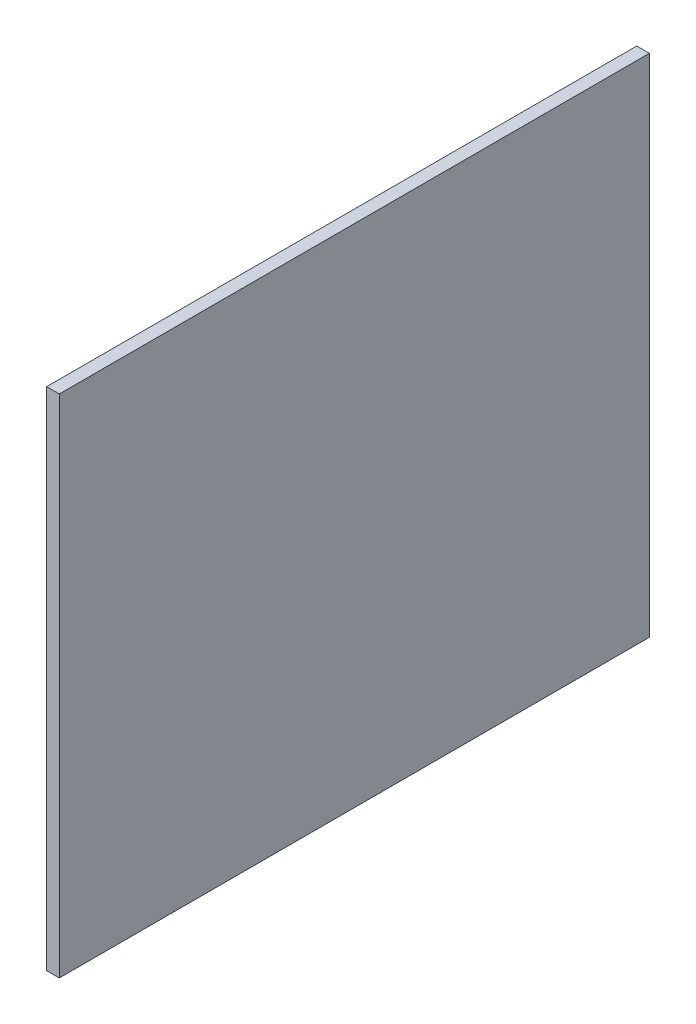
from build123d import *

# Parameters (mm, degrees)
SKETCH1_W           = 120
SKETCH1_H           = 140
BOSS_EXTRUDE1_DEPTH = 3


with BuildPart() as part:
    # Sketch1 → Boss-Extrude1 (new body)
    with BuildSketch(Plane.YZ):
        with Locations((60, 70)):
            Rectangle(SKETCH1_W, SKETCH1_H)
    extrude(amount=BOSS_EXTRUDE1_DEPTH)


solid = part.part
